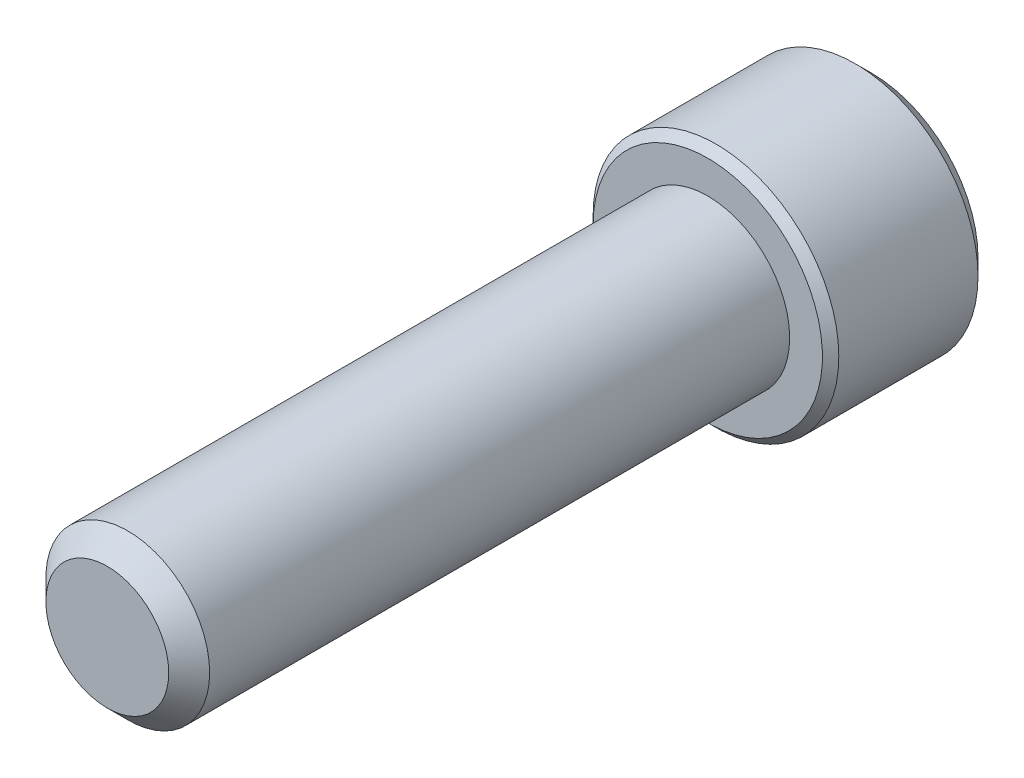
from build123d import *

# Parameters (mm, degrees)
SKETCH1_R          = 4.7625
EXTRUDE1_DEPTH     = 34.925
SKETCH6_R          = 7.14375
EXTRUDE2_DEPTH     = 9.525
CUT_EXTRUDE1_DEPTH = 5.953125
SKETCH8_R          = 4.582717762
CUT_EXTRUDE2_DEPTH = 0.9525
CUT_EXTRUDE2_DRAFT = -45
CHAMFER1_SIZE      = 0.9525
CHAMFER2_SIZE      = 0.47625
CHAMFER3_SIZE      = 1.190625


with BuildPart() as part:
    # Sketch1 → Extrude1 (new body)
    with BuildSketch(Plane.XY):
        Circle(SKETCH1_R)
    extrude(amount=-EXTRUDE1_DEPTH)

    # Sketch6 → Extrude2 (add)
    with BuildSketch(Plane(origin=(0, 0, -34.925), x_dir=(-1, 0, 0), z_dir=(0, 0, -1))):
        with Locations(Location((0, 0, 0), (0, 0, 180))):
            Circle(SKETCH6_R)
    extrude(amount=EXTRUDE2_DEPTH)

    # Sketch7 → Cut-Extrude1 (cut)
    with BuildSketch(Plane(origin=(0, 0, -44.45), x_dir=(-1, 0, 0), z_dir=(0, 0, -1))):
        Polygon((0, 4.582717762), (-3.96875, 2.291358881), (-3.96875, -2.291358881), (0, -4.582717762), (3.96875, -2.291358881), (3.96875, 2.291358881), align=None)
    extrude(amount=-CUT_EXTRUDE1_DEPTH, mode=Mode.SUBTRACT)


with BuildPart() as cut_extrude2_tool:
    # Sketch8 → Cut-Extrude2 (with draft: the straight prism first)
    with BuildSketch(Plane(origin=(0, 0, -44.45), x_dir=(-1, 0, 0), z_dir=(0, 0, -1))):
        Circle(SKETCH8_R)
    extrude(amount=-CUT_EXTRUDE2_DEPTH)
    # Cut-Extrude2: the draft: its side faces are tilted about the plane it starts from
    cut_extrude2_sides = [cut_extrude2_tool.faces().sort_by_distance(p)[0] for p in [
        (4.582717762, 0, -43.97375),
    ]]
    draft(cut_extrude2_sides, Plane(origin=(0, 0, -44.45), x_dir=(-1, 0, 0), z_dir=(0, 0, -1)), CUT_EXTRUDE2_DRAFT)


with BuildPart() as part_1:
    add(part.part)

    # Cut-Extrude2: cut by cut_extrude2_tool
    add(cut_extrude2_tool.part, mode=Mode.SUBTRACT)

    # Chamfer1
    chamfer1_edges = [part_1.edges().sort_by_distance(p)[0] for p in [
        (-7.14375, 0, -44.45),
    ]]
    chamfer(chamfer1_edges, length=CHAMFER1_SIZE)

    # Chamfer2
    chamfer2_edges = [part_1.edges().sort_by_distance(p)[0] for p in [
        (-7.14375, 0, -34.925),
    ]]
    chamfer(chamfer2_edges, length=CHAMFER2_SIZE)

    # Chamfer3
    chamfer3_edges = [part_1.edges().sort_by_distance(p)[0] for p in [
        (-4.7625, 0, 0),
    ]]
    chamfer(chamfer3_edges, length=CHAMFER3_SIZE)


solid = part_1.part
